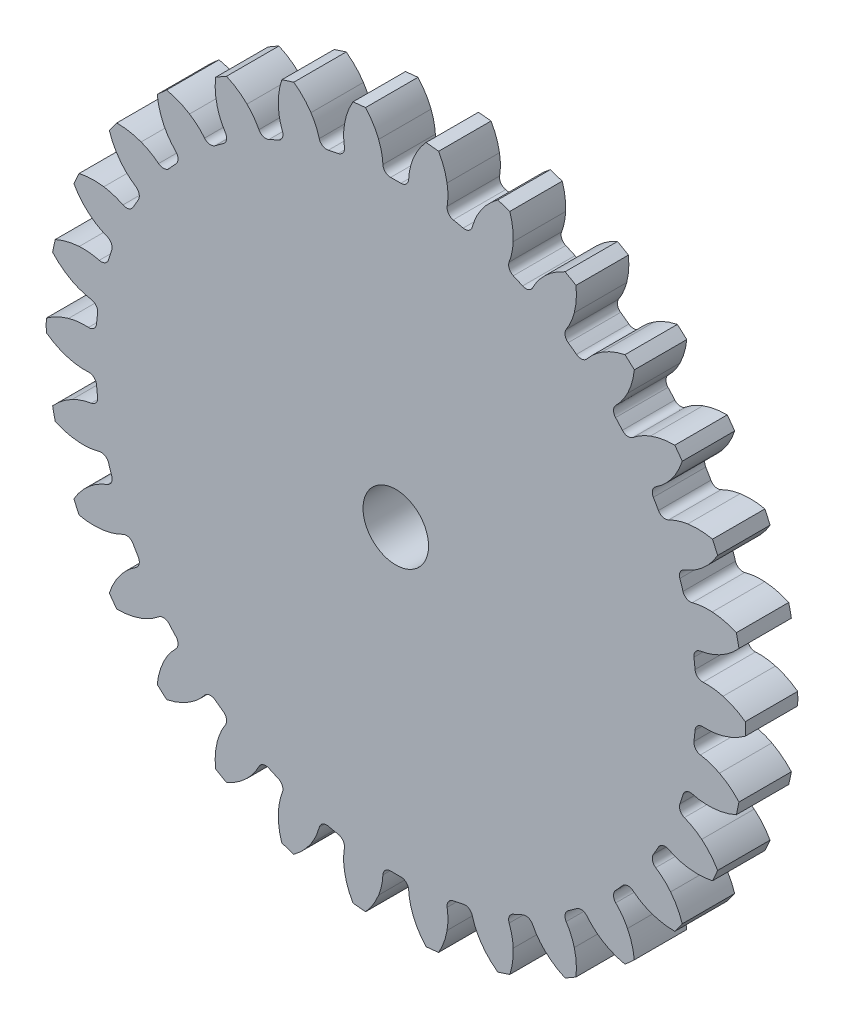
from build123d import *

# Parameters (mm, degrees)
SKETCH1_R        = 50.8
GEAR_BASE_DEPTH  = 3.81
GEAR_CUT_DEPTH   = 73.245030279
GEAR_TEETH_COUNT = 30
SKETCH3_R        = 4.7625
BORE_DEPTH       = 73.11113083


with BuildPart() as part:
    # Sketch1 → GEAR_BASE (new, symmetric)
    with BuildSketch(Plane.XY):
        Circle(SKETCH1_R)
    extrude(amount=GEAR_BASE_DEPTH, both=True)

    # Sketch2 → GEAR_CUT (cut, through all)
    with BuildSketch(Plane.XY.offset(3.81)):
        with BuildLine():
            ThreePointArc((-49.872591357, -9.662537522), (-50.521712285, -5.310045934), (-50.791710092, -0.917706901))
            ThreePointArc((-50.791710092, -0.917706901), (-49.247291805, -1.852666983), (-47.559654919, -2.4939625))
            ThreePointArc((-47.559654919, -2.4939625), (-46.120309896, -2.772253488), (-44.654879163, -2.813152568))
            ThreePointArc((-44.654879163, -2.813152568), (-43.86698879, -3.08349419), (-43.488323172, -3.825429621))
            ThreePointArc((-43.488323172, -3.825429621), (-43.417096495, -4.563320725), (-43.333350511, -5.299895996))
            ThreePointArc((-43.333350511, -5.299895996), (-43.549484327, -6.104347366), (-44.263950221, -6.532592995))
            ThreePointArc((-44.263950221, -6.532592995), (-45.68885438, -6.877278514), (-47.038886311, -7.448744833))
            ThreePointArc((-47.038886311, -7.448744833), (-48.556311447, -8.426905943), (-49.872591357, -9.662537522))
        make_face()
    gear_cut = extrude(amount=-GEAR_CUT_DEPTH, mode=Mode.SUBTRACT)

    # GEAR_TEETH: GEAR_CUT ×30 about axis
    gear_teeth_axis = Axis((0, 0, -3.2131), (0, 0, 1))
    for i in range(1, GEAR_TEETH_COUNT):
        add(gear_cut.rotate(gear_teeth_axis, i * 360 / GEAR_TEETH_COUNT), mode=Mode.SUBTRACT)

    # Sketch3 → BORE (cut, through all)
    with BuildSketch(Plane.XY.offset(3.81)):
        Circle(SKETCH3_R)
    extrude(amount=-BORE_DEPTH, mode=Mode.SUBTRACT)


solid = part.part
